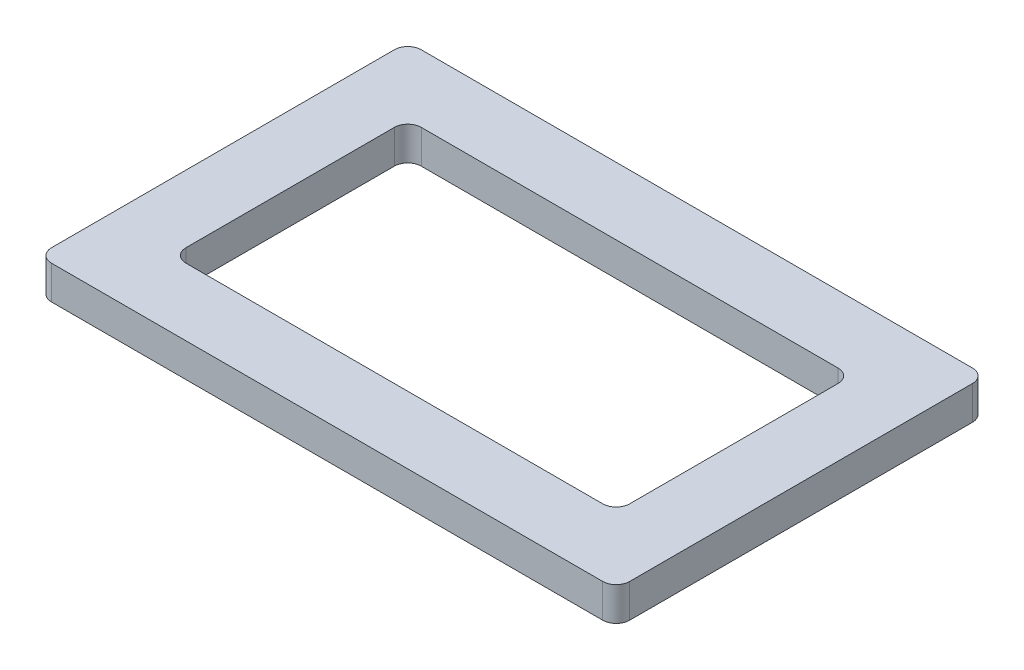
from build123d import *

# Parameters (mm, degrees)
SKETCH1_W           = 86
SKETCH1_H           = 55
BOSS_EXTRUDE1_DEPTH = 5
SKETCH2_R           = 7.5
CUT_EXTRUDE1_DEPTH  = 52.285962992
SKETCH3_W           = 66
SKETCH3_H           = 35
CUT_EXTRUDE2_DEPTH  = 52.285962992
FILLET1_R           = 2


with BuildPart() as part:
    # Sketch1 → Boss-Extrude1 (new body)
    with BuildSketch(Plane(origin=(0, 0, 0), x_dir=(1, 0, 0), z_dir=(0, 1, 0))):
        Rectangle(SKETCH1_W, SKETCH1_H)
    extrude(amount=BOSS_EXTRUDE1_DEPTH)

    # Sketch2 → Cut-Extrude1 (cut, through all)
    with BuildSketch(Plane(origin=(0, 5, 0), x_dir=(1, 0, 0), z_dir=(0, 1, 0))):
        with Locations(Location((19, -2.5, 0), (0, 0, 270))):
            Circle(SKETCH2_R)
    extrude(amount=-CUT_EXTRUDE1_DEPTH, mode=Mode.SUBTRACT)

    # Sketch3 → Cut-Extrude2 (cut, through all)
    with BuildSketch(Plane(origin=(0, 5, 0), x_dir=(1, 0, 0), z_dir=(0, 1, 0))):
        Rectangle(SKETCH3_W, SKETCH3_H)
    extrude(amount=-CUT_EXTRUDE2_DEPTH, mode=Mode.SUBTRACT)

    # Fillet1
    fillet1_edges = [part.edges().sort_by_distance(p)[0] for p in [
        (33, 2.5, -17.5),
        (33, 2.5, 17.5),
        (-33, 2.5, 17.5),
        (-33, 2.5, -17.5),
        (43, 2.5, 27.5),
        (-43, 2.5, 27.5),
        (-43, 2.5, -27.5),
        (43, 2.5, -27.5),
    ]]
    fillet(fillet1_edges, radius=FILLET1_R)


solid = part.part
